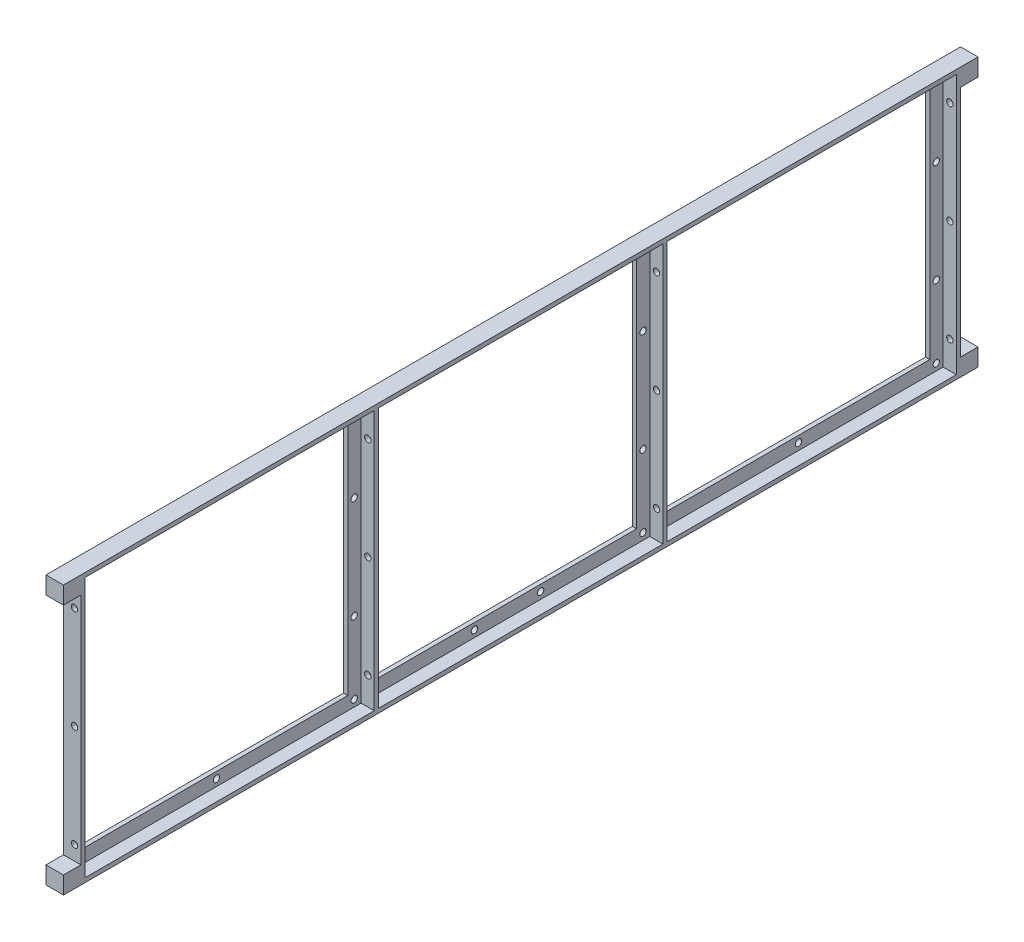
from build123d import *

# Parameters (mm, degrees)
SKETCH2_W             = 6.5
SKETCH2_H             = 6.5
RAILS_DEPTH           = 340.5
RAILS_2_DEPTH         = 340.5
SKETCH3_W             = 6.5
SKETCH3_H             = 87
FRONT_STRUT_DEPTH     = 1.5875
SKETCH4_W             = 6.5
SKETCH4_H             = 87
FRONT_MID_STRUT_DEPTH = 0.79375
SKETCH5_W             = 6.5
SKETCH5_H             = 87
BACK_MID_STRUT_DEPTH  = 0.79375
SKETCH6_W             = 6.5
SKETCH6_H             = 87
BACK_STRUT_DEPTH      = 1.5875
SKETCH7_W             = 4.9125
SKETCH7_H             = 87
X_SIDE_FLANGES_DEPTH  = 1.5875
SKETCH8_W             = 107.618749964
SKETCH8_H             = 4.9125
SKETCH8_W_2           = 105.912500092
FRAME_INSERTS_DEPTH   = 4.9125
SKETCH9_R             = 1.190625
Z_SCREWHOLES_DEPTH    = 349.70940624
SKETCH10_R            = 1.190625
X_SCREWHOLES_DEPTH    = 355.940135798


with BuildPart() as part:
    # Sketch2 → rails (new body)
    with BuildSketch(Plane.XY):
        with Locations((3.25, 3.25)):
            Rectangle(SKETCH2_W, SKETCH2_H)
    extrude(amount=-RAILS_DEPTH)



with BuildPart() as body_2:
    # Sketch2 → rails 2 (new body)
    with BuildSketch(Plane.XY):
        with Locations((3.25, 96.75)):
            Rectangle(SKETCH2_W, SKETCH2_H)
    extrude(amount=-RAILS_2_DEPTH)


with BuildPart() as part_1:
    add(part.part)

    add(body_2.part)  # front strut merges body 2
    # Sketch3 → front strut (add)
    with BuildSketch(Plane.XY.offset(-6.5)):
        with Locations((3.25, 50)):
            Rectangle(SKETCH3_W, SKETCH3_H)
    extrude(amount=-FRONT_STRUT_DEPTH)

    # Sketch4 → front mid strut (add, symmetric)
    with BuildSketch(Plane.XY.offset(-116.499999964)):
        with Locations((3.25, 50)):
            Rectangle(SKETCH4_W, SKETCH4_H)
    extrude(amount=FRONT_MID_STRUT_DEPTH, both=True)

    # Sketch5 → back mid strut (add, symmetric)
    with BuildSketch(Plane.XY.offset(-224.000000056)):
        with Locations((3.25, 50)):
            Rectangle(SKETCH5_W, SKETCH5_H)
    extrude(amount=BACK_MID_STRUT_DEPTH, both=True)

    # Sketch6 → back strut (add)
    with BuildSketch(Plane.XY.offset(-334.00000002)):
        with Locations((3.25, 50)):
            Rectangle(SKETCH6_W, SKETCH6_H)
    extrude(amount=BACK_STRUT_DEPTH)

    # Sketch7 → x side flanges (add)
    with BuildSketch(Plane(origin=(0, 0, 0), x_dir=(0, 0, -1), z_dir=(1, 0, 0))):
        with Locations((10.54375, 50)):
            Rectangle(SKETCH7_W, SKETCH7_H)
        with Locations((113.249999964, 50)):
            Rectangle(SKETCH7_W, SKETCH7_H)
        with Locations((119.749999964, 50)):
            Rectangle(SKETCH7_W, SKETCH7_H)
        with Locations((220.750000056, 50)):
            Rectangle(SKETCH7_W, SKETCH7_H)
        with Locations((227.250000056, 50)):
            Rectangle(SKETCH7_W, SKETCH7_H)
        with Locations((329.95625002, 50)):
            Rectangle(SKETCH7_W, SKETCH7_H)
    extrude(amount=X_SIDE_FLANGES_DEPTH)

    # Sketch8 → frame inserts (cut)
    with BuildSketch(Plane(origin=(6.5, 0, 0), x_dir=(0, 0, -1), z_dir=(1, 0, 0))):
        with Locations((61.896874982, 4.04375)):
            Rectangle(SKETCH8_W, SKETCH8_H)
        with Locations((61.896874982, 95.95625)):
            Rectangle(SKETCH8_W, SKETCH8_H)
        with Locations((170.25000001, 95.95625)):
            Rectangle(SKETCH8_W_2, SKETCH8_H)
        with Locations((170.25000001, 4.04375)):
            Rectangle(SKETCH8_W_2, SKETCH8_H)
        with Locations((278.603125038, 4.04375)):
            Rectangle(SKETCH8_W, SKETCH8_H)
        with Locations((278.603125038, 95.95625)):
            Rectangle(SKETCH8_W, SKETCH8_H)
    extrude(amount=-FRAME_INSERTS_DEPTH, mode=Mode.SUBTRACT)

    # Sketch9 → z screwholes (cut, through all)
    with BuildSketch(Plane.XY.offset(-6.5)):
        with Locations((4.11875, 88.1)):
            Circle(SKETCH9_R)
        with Locations((4.11875, 50)):
            Circle(SKETCH9_R)
        with Locations((4.11875, 11.9)):
            Circle(SKETCH9_R)
    extrude(amount=-Z_SCREWHOLES_DEPTH, mode=Mode.SUBTRACT)

    # Sketch10 → x screwholes (cut, through all)
    with BuildSketch(Plane(origin=(0, 0, 0), x_dir=(0, 0, -1), z_dir=(1, 0, 0))):
        with Locations(Location((10.61875, 95.88125, 0), (0, 0, 180))):
            Circle(SKETCH10_R)
        with Locations(Location((113.174999964, 95.88125, 0), (0, 0, 180))):
            Circle(SKETCH10_R)
        with Locations(Location((61.896874982, 95.88125, 0), (0, 0, 180))):
            Circle(SKETCH10_R)
        with Locations(Location((119.824999964, 95.88125, 0), (0, 0, 180))):
            Circle(SKETCH10_R)
        with Locations(Location((157.924999964, 95.88125, 0), (0, 0, 180))):
            Circle(SKETCH10_R)
        with Locations(Location((10.61875, 69.05, 0), (0, 0, 180))):
            Circle(SKETCH10_R)
        with Locations(Location((113.174999964, 69.05, 0), (0, 0, 180))):
            Circle(SKETCH10_R)
        with Locations(Location((119.824999964, 69.05, 0), (0, 0, 180))):
            Circle(SKETCH10_R)
        with Locations(Location((220.675000056, 69.05, 0), (0, 0, 180))):
            Circle(SKETCH10_R)
        with Locations(Location((227.325000056, 69.05, 0), (0, 0, 180))):
            Circle(SKETCH10_R)
        with Locations(Location((329.88125002, 69.05, 0), (0, 0, 180))):
            Circle(SKETCH10_R)
        with Locations(Location((182.575000056, 95.88125, 0), (0, 0, 180))):
            Circle(SKETCH10_R)
        with Locations(Location((220.675000056, 95.88125, 0), (0, 0, 180))):
            Circle(SKETCH10_R)
        with Locations(Location((278.603125038, 95.88125, 0), (0, 0, 180))):
            Circle(SKETCH10_R)
        with Locations(Location((227.325000056, 95.88125, 0), (0, 0, 180))):
            Circle(SKETCH10_R)
        with Locations(Location((329.88125002, 95.88125, 0), (0, 0, 180))):
            Circle(SKETCH10_R)
        with Locations(Location((329.88125002, 4.11875, 0), (0, 0, 180))):
            Circle(SKETCH10_R)
        with Locations(Location((227.325000056, 4.11875, 0), (0, 0, 180))):
            Circle(SKETCH10_R)
        with Locations(Location((278.603125038, 4.11875, 0), (0, 0, 180))):
            Circle(SKETCH10_R)
        with Locations(Location((220.675000056, 4.11875, 0), (0, 0, 180))):
            Circle(SKETCH10_R)
        with Locations(Location((182.575000056, 4.11875, 0), (0, 0, 180))):
            Circle(SKETCH10_R)
        with Locations(Location((329.88125002, 30.95, 0), (0, 0, 180))):
            Circle(SKETCH10_R)
        with Locations(Location((227.325000056, 30.95, 0), (0, 0, 180))):
            Circle(SKETCH10_R)
        with Locations(Location((220.675000056, 30.95, 0), (0, 0, 180))):
            Circle(SKETCH10_R)
        with Locations(Location((119.824999964, 30.95, 0), (0, 0, 180))):
            Circle(SKETCH10_R)
        with Locations(Location((113.174999964, 30.95, 0), (0, 0, 180))):
            Circle(SKETCH10_R)
        with Locations(Location((10.61875, 30.95, 0), (0, 0, 180))):
            Circle(SKETCH10_R)
        with Locations(Location((157.924999964, 4.11875, 0), (0, 0, 180))):
            Circle(SKETCH10_R)
        with Locations(Location((119.824999964, 4.11875, 0), (0, 0, 180))):
            Circle(SKETCH10_R)
        with Locations(Location((61.896874982, 4.11875, 0), (0, 0, 180))):
            Circle(SKETCH10_R)
        with Locations(Location((113.174999964, 4.11875, 0), (0, 0, 180))):
            Circle(SKETCH10_R)
        with Locations(Location((10.61875, 4.11875, 0), (0, 0, 180))):
            Circle(SKETCH10_R)
    extrude(amount=X_SCREWHOLES_DEPTH, mode=Mode.SUBTRACT)


solid = part_1.part
